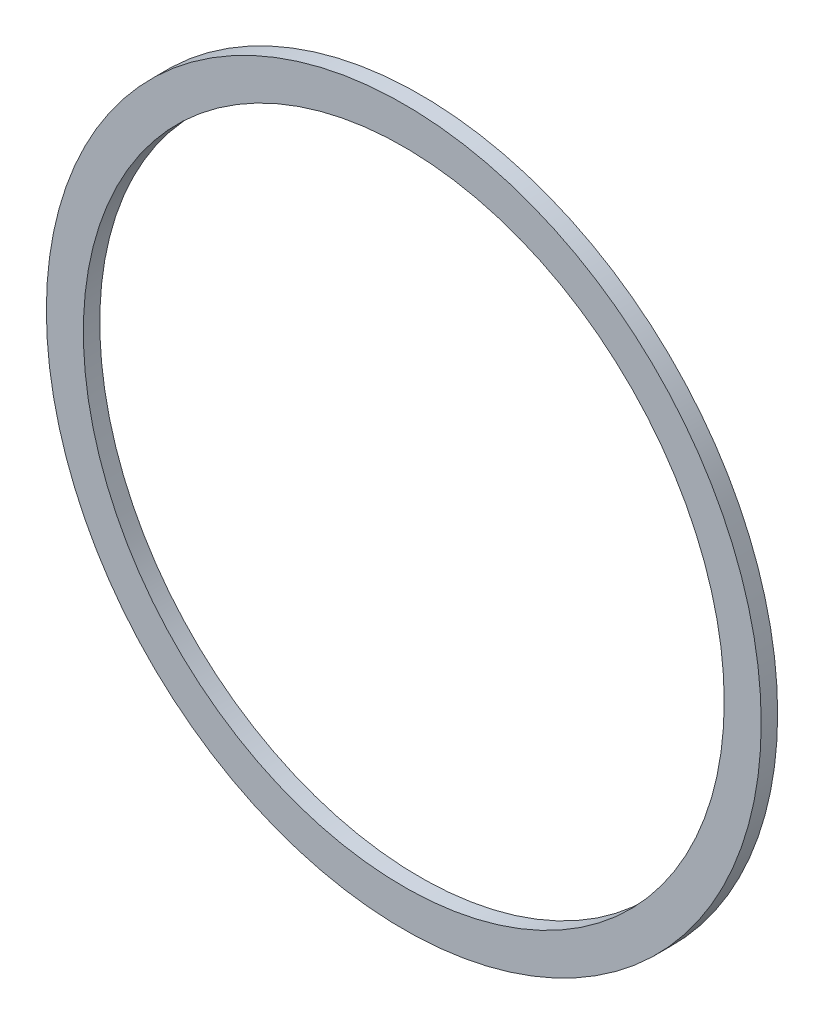
from build123d import *

# Parameters (mm, degrees)
ESQUISSE1_R        = 43.5
ESQUISSE1_R_2      = 39
BOSS_EXTRU_1_DEPTH = 2


with BuildPart() as part:
    # Esquisse1 → Boss.-Extru.1 (new body)
    with BuildSketch(Plane.XY):
        Circle(ESQUISSE1_R)
        Circle(ESQUISSE1_R_2, mode=Mode.SUBTRACT)
    extrude(amount=BOSS_EXTRU_1_DEPTH)


solid = part.part
